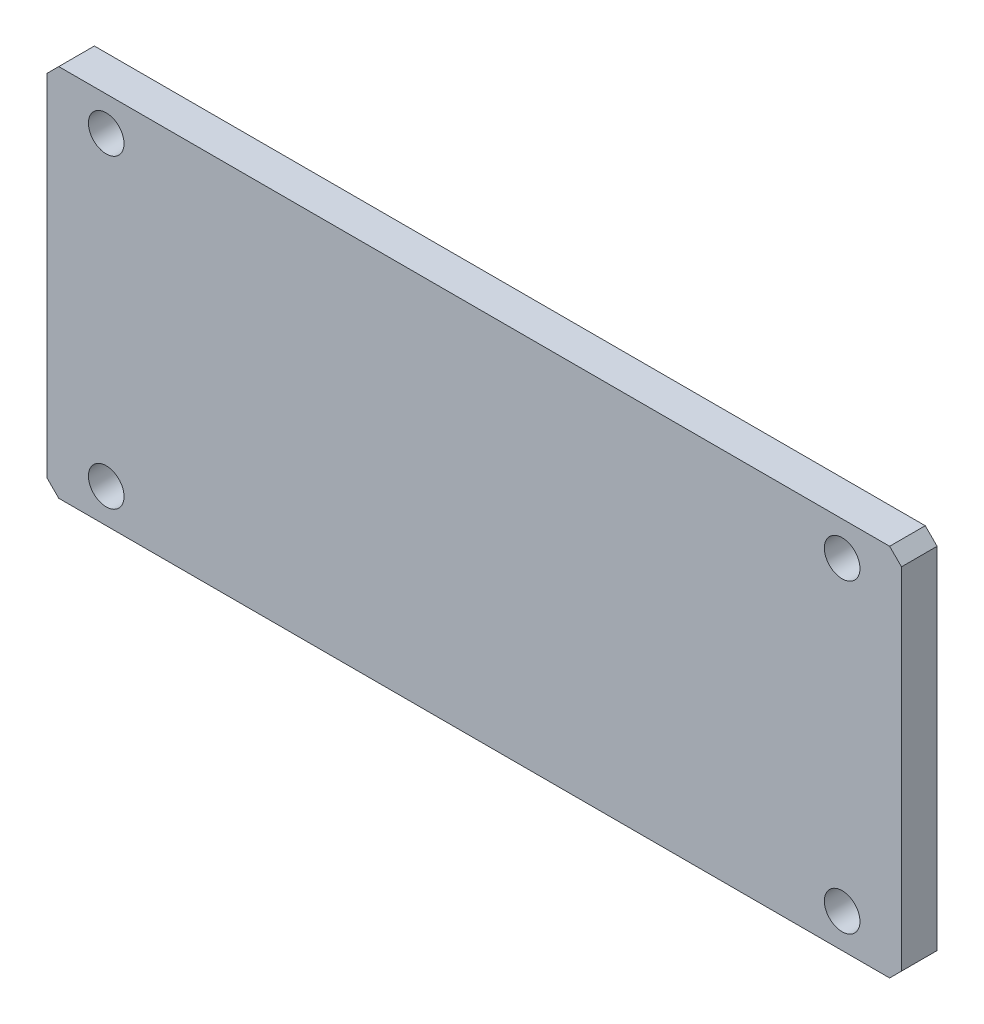
from build123d import *

# Parameters (mm, degrees)
SKETCH_1_R      = 1.5
EXTRUDE_1_DEPTH = 3


with BuildPart() as part:
    # 草图1 → 凸台-拉伸1 (new body)
    with BuildSketch(Plane(origin=(0, -1e-09, -173.255225947), x_dir=(-1, 0, 0), z_dir=(0, -6.574601973952099e-12, -1.0))):
        Polygon((140.897185772, 110.699246417), (210.897185773, 110.699246417), (211.897185773, 111.699246417), (211.897185773, 141.199246417), (210.897185773, 142.199246417), (140.897185772, 142.199246417), (139.897185772, 141.199246417), (139.897185772, 111.699246417), align=None)
        with Locations(Location((206.897185772, 139.324246417, 0), (0, 0, 90))):
            Circle(SKETCH_1_R, mode=Mode.SUBTRACT)
        with Locations(Location((206.897185773, 113.574246417, 0), (0, 0, 90))):
            Circle(SKETCH_1_R, mode=Mode.SUBTRACT)
        with Locations(Location((144.897185773, 113.574246415, 0), (0, 0, 90))):
            Circle(SKETCH_1_R, mode=Mode.SUBTRACT)
        with Locations(Location((144.897185772, 139.324246415, 0), (0, 0, 90))):
            Circle(SKETCH_1_R, mode=Mode.SUBTRACT)
    extrude(amount=EXTRUDE_1_DEPTH)


solid = part.part
